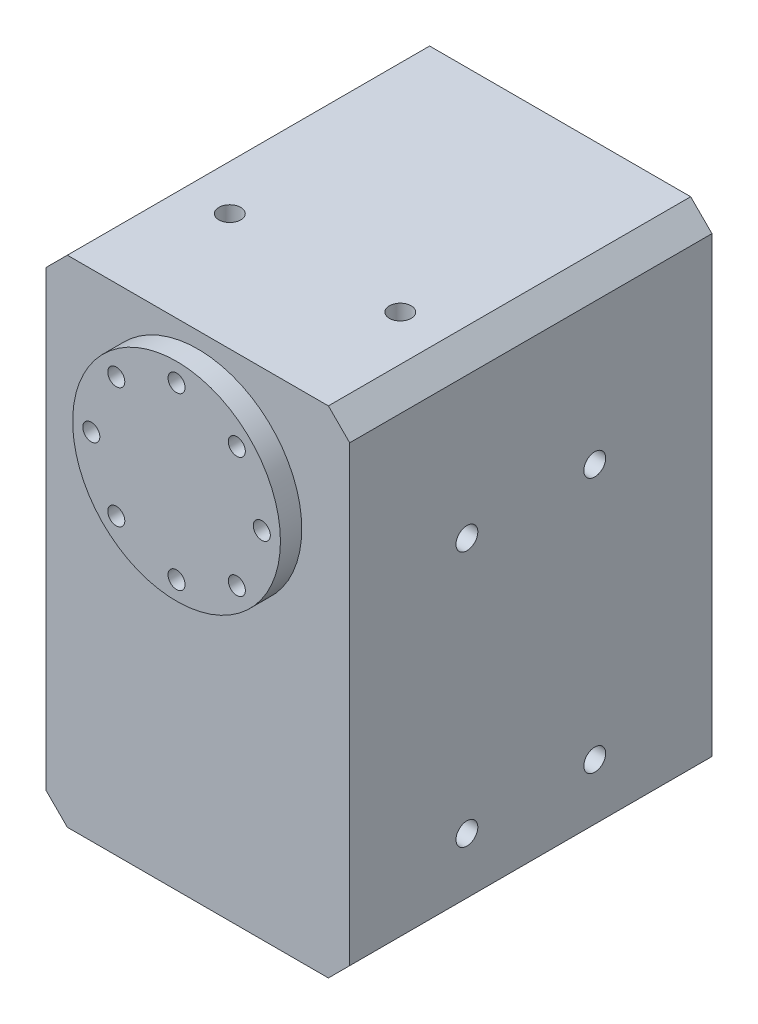
from build123d import *

# Parameters (mm, degrees)
ESQUISSE1_W             = 28.5
ESQUISSE1_H             = 46.5
BOSS_EXTRU_1_DEPTH      = 34
ESQUISSE2_R             = 9.75
ESQUISSE2_R_2           = 0.8
BOSS_EXTRU_2_DEPTH      = 2
ESQUISSE3_R             = 1.025
ENL_V_MAT_EXTRU_1_DEPTH = 3
ESQUISSE4_R             = 1.025
ENL_V_MAT_EXTRU_2_DEPTH = 3
ENL_V_START             = -3
ESQUISSE5_R             = 1.025
ENL_V_MAT_EXTRU_3_DEPTH = 3
ESQUISSE6_R             = 1.025
ENL_V_MAT_EXTRU_4_DEPTH = 3
CHANFREIN1_SIZE         = 2


with BuildPart() as part:
    # Esquisse1 → Boss.-Extru.1 (new body)
    with BuildSketch(Plane.XY):
        Rectangle(ESQUISSE1_W, ESQUISSE1_H)
    extrude(amount=BOSS_EXTRU_1_DEPTH)

    # Esquisse2 → Boss.-Extru.2 (add)
    with BuildSketch(Plane.XY.offset(34)):
        with Locations((0, 12)):
            Circle(ESQUISSE2_R)
        with Locations((0, 20)):
            Circle(ESQUISSE2_R_2, mode=Mode.SUBTRACT)
        with Locations((5.656854249, 17.656854249)):
            Circle(ESQUISSE2_R_2, mode=Mode.SUBTRACT)
        with Locations((8, 12)):
            Circle(ESQUISSE2_R_2, mode=Mode.SUBTRACT)
        with Locations((5.656854249, 6.343145751)):
            Circle(ESQUISSE2_R_2, mode=Mode.SUBTRACT)
        with Locations((0, 4)):
            Circle(ESQUISSE2_R_2, mode=Mode.SUBTRACT)
        with Locations((-5.656854249, 6.343145751)):
            Circle(ESQUISSE2_R_2, mode=Mode.SUBTRACT)
        with Locations((-8, 12)):
            Circle(ESQUISSE2_R_2, mode=Mode.SUBTRACT)
        with Locations((-5.656854249, 17.656854249)):
            Circle(ESQUISSE2_R_2, mode=Mode.SUBTRACT)
    extrude(amount=BOSS_EXTRU_2_DEPTH)

    # Esquisse3 → Enlèv. mat.-Extru.1 (cut)
    with BuildSketch(Plane(origin=(0, 23.25, 0), x_dir=(1, 0, 0), z_dir=(0, 1, 0))):
        with Locations(Location((-8, -23, 0), (0, 0, 270))):
            Circle(ESQUISSE3_R)
        with Locations(Location((8, -23, 0), (0, 0, 270))):
            Circle(ESQUISSE3_R)
    extrude(amount=-ENL_V_MAT_EXTRU_1_DEPTH, mode=Mode.SUBTRACT)

    # Esquisse4 → Enlèv. mat.-Extru.2 (cut)
    with BuildSketch(Plane.ZY.offset(14.25)):
        with Locations(Location((23, 8, 0), (0, 0, 270))):
            Circle(ESQUISSE4_R)
        with Locations(Location((11, 8, 0), (0, 0, 270))):
            Circle(ESQUISSE4_R)
        with Locations(Location((23, -16, 0), (0, 0, 270))):
            Circle(ESQUISSE4_R)
        with Locations(Location((11, -16, 0), (0, 0, 270))):
            Circle(ESQUISSE4_R)
    extrude(amount=-ENL_V_MAT_EXTRU_2_DEPTH, mode=Mode.SUBTRACT)

    # Esquisse5 → Enlèv. mat.-Extru.3 (cut)
    with BuildSketch(Plane(origin=(14.25, 0, 0), x_dir=(0, 0, -1), z_dir=(1, 0, 0)).offset(ENL_V_START)):
        with Locations(Location((-11, -16, 0), (0, 0, 270))):
            Circle(ESQUISSE5_R)
        with Locations(Location((-23, -16, 0), (0, 0, 270))):
            Circle(ESQUISSE5_R)
        with Locations(Location((-23, 8, 0), (0, 0, 270))):
            Circle(ESQUISSE5_R)
        with Locations(Location((-11, 8, 0), (0, 0, 270))):
            Circle(ESQUISSE5_R)
    extrude(amount=ENL_V_MAT_EXTRU_3_DEPTH, mode=Mode.SUBTRACT)

    # Esquisse6 → Enlèv. mat.-Extru.4 (cut)
    with BuildSketch(Plane.XZ.offset(23.25).offset(ENL_V_START)):
        with Locations(Location((-8, 23, 0), (0, 0, 90))):
            Circle(ESQUISSE6_R)
        with Locations(Location((8, 23, 0), (0, 0, 90))):
            Circle(ESQUISSE6_R)
        with Locations(Location((-8, 11, 0), (0, 0, 270))):
            Circle(ESQUISSE6_R)
        with Locations(Location((8, 11, 0), (0, 0, 270))):
            Circle(ESQUISSE6_R)
    extrude(amount=ENL_V_MAT_EXTRU_4_DEPTH, mode=Mode.SUBTRACT)

    # Chanfrein1
    chanfrein1_edges = [part.edges().sort_by_distance(p)[0] for p in [
        (-14.25, 23.25, 17),
        (14.25, 23.25, 17),
        (14.25, -23.25, 17),
        (-14.25, -23.25, 17),
    ]]
    chamfer(chanfrein1_edges, length=CHANFREIN1_SIZE)


solid = part.part
